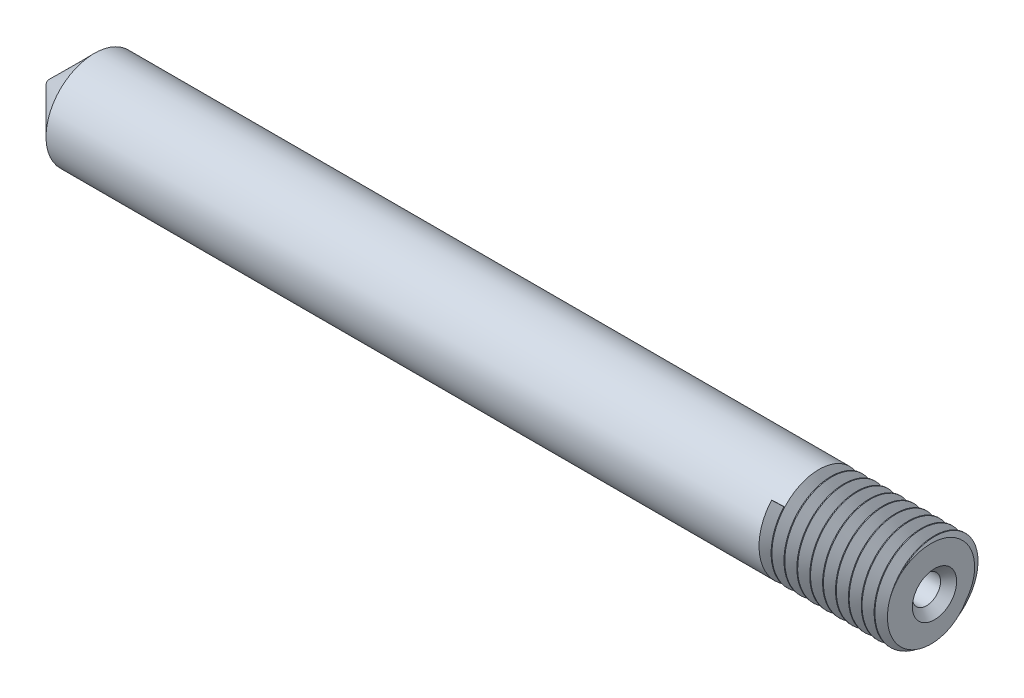
from build123d import *

# Parameters (mm, degrees)
SMUSSO1_SIZE               = 0.5
TAGLIA_SWEEP13_PITCH       = 0.8
TAGLIA_SWEEP13_HEIGHT      = 8
TAGLIA_SWEEP13_RADIUS      = 3
TAGLIA_SWEEP13_START_ANGLE = -135


with BuildPart() as part:
    # Schizzo3 → Rivoluzione1 (revolve)
    with BuildSketch(Plane(origin=(0, 0, 0), x_dir=(1, 0, 0), z_dir=(0, 1, 0))):
        Polygon((0, 3), (0, 0.875), (-52.330865705, 0.875), (-53.5, 0.2), (-55, 0.2), (-52.2, 3), align=None)
    revolve(axis=Axis((0, 0, 0), (-1, 0, 0)))

    # Smusso1
    smusso1_edges = [part.edges().sort_by_distance(p)[0] for p in [
        (0, 0, 0.875),
    ]]
    chamfer(smusso1_edges, length=SMUSSO1_SIZE)

    # Taglia-Sweep13: sweep along a helix
    with BuildLine() as taglia_sweep13_path:
        add(Helix(TAGLIA_SWEEP13_PITCH, TAGLIA_SWEEP13_HEIGHT, TAGLIA_SWEEP13_RADIUS, center=(0, 0, 0), direction=(-1, 0, 0), mode=Mode.PRIVATE).rotate(Axis((0, 0, 0), (-1, 0, 0)), TAGLIA_SWEEP13_START_ANGLE))
    # Schizzo8 → Taglia-Sweep13 (sweep, cut)
    with BuildSketch(Plane(origin=(0, 2.121320344, 2.121320344), x_dir=(0.9991005821420479, 0.029983551852818452, -0.02998355185281811), z_dir=(-0.042403145678372556, 0.7064707967200734, -0.7064707967200652))):
        Polygon((0.375, 0.648890499), (0.75, -0.000628554), (0, -0.000628554), align=None)
    sweep(path=taglia_sweep13_path.line, is_frenet=True, mode=Mode.SUBTRACT)


solid = part.part
